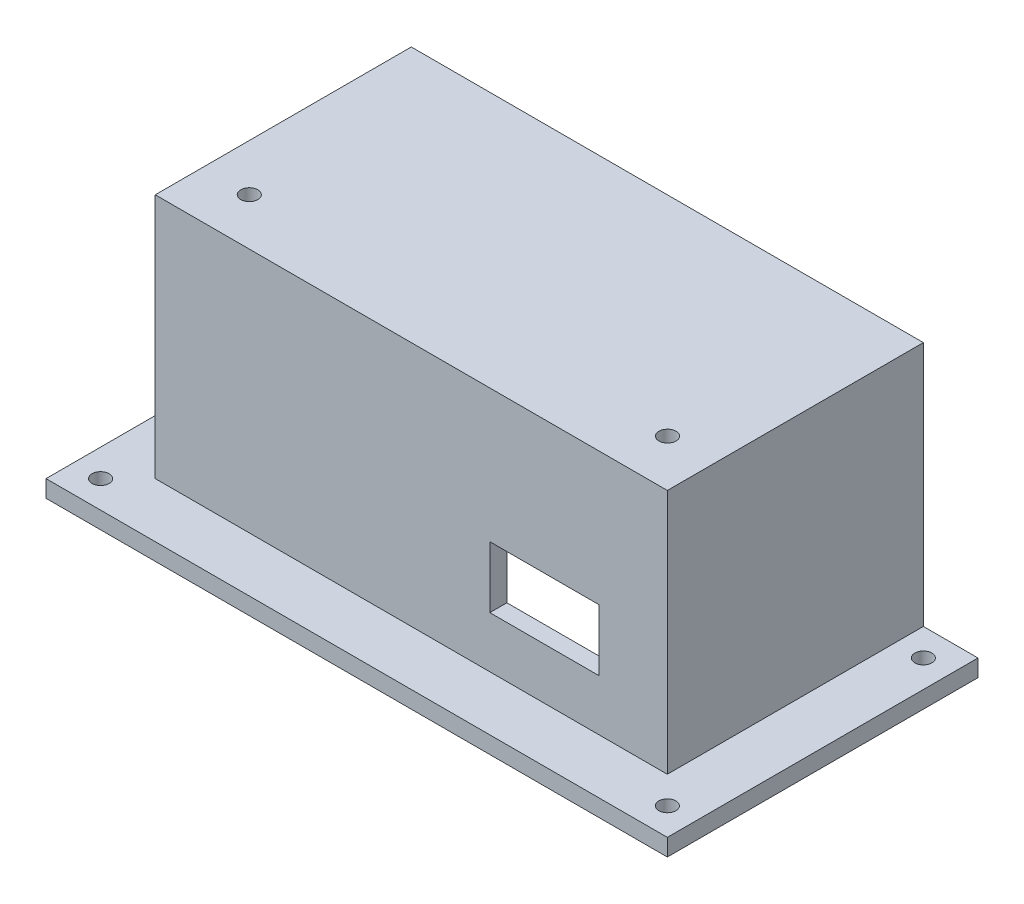
from build123d import *

# Parameters (mm, degrees)
SKETCH1_W                = 88.9
SKETCH1_H                = 44.45
BOSS_EXTRUDE1_DEPTH      = 3.175
BOSS_EXTRUDE2_DEPTH      = 45.72
BOSS_EXTRUDE2_DEPTH_BACK = 3.175
SKETCH3_R                = 1.5875
CUT_EXTRUDE1_DEPTH       = 45.72
SKETCH4_W                = 10.16
SKETCH4_H                = 47.625
SKETCH4_H_2              = 10.16
SKETCH4_W_2              = 95.25
BOSS_EXTRUDE3_DEPTH      = 3.175
SKETCH5_R                = 1.5875
CUT_EXTRUDE2_DEPTH       = 3.175
SKETCH6_W                = 20.32
SKETCH6_H                = 11.43
CUT_EXTRUDE3_DEPTH       = 3.175
SKETCH7_W                = 44.45
SKETCH7_H                = 12.7
BOSS_EXTRUDE4_DEPTH      = 3.175


with BuildPart() as part:
    # Sketch1 → Boss-Extrude1 (new body)
    with BuildSketch(Plane(origin=(0, 0, 0), x_dir=(1, 0, 0), z_dir=(0, 1, 0))):
        with Locations((44.45, 22.225)):
            Rectangle(SKETCH1_W, SKETCH1_H)
    extrude(amount=BOSS_EXTRUDE1_DEPTH)

    # Sketch2 → Boss-Extrude2 (add, two sides: drawn at the far end of the back side and taken through both)
    with BuildSketch(Plane.XZ.offset(-BOSS_EXTRUDE2_DEPTH_BACK)):
        Polygon((-3.175, 3.175), (-3.175, -44.45), (0, -44.45), (0, 0), (88.9, 0), (88.9, -44.45), (92.075, -44.45), (92.075, 3.175), align=None)
    extrude(amount=BOSS_EXTRUDE2_DEPTH + BOSS_EXTRUDE2_DEPTH_BACK)

    # Sketch3 → Cut-Extrude1 (cut)
    with BuildSketch(Plane.XZ):
        with Locations(Location((83.34375, -5.588, 0), (0, 0, 270))):
            Circle(SKETCH3_R)
        with Locations(Location((5.55625, -5.588, 0), (0, 0, 270))):
            Circle(SKETCH3_R)
    extrude(amount=-CUT_EXTRUDE1_DEPTH, mode=Mode.SUBTRACT)

    # Sketch4 → Boss-Extrude3 (add)
    with BuildSketch(Plane.XZ.offset(45.72)):
        with Locations((-8.255, -20.6375)):
            Rectangle(SKETCH4_W, SKETCH4_H)
        with Locations((-8.255, 8.255)):
            Rectangle(SKETCH4_W, SKETCH4_H_2)
        with Locations((44.45, 8.255)):
            Rectangle(SKETCH4_W_2, SKETCH4_H_2)
        Polygon((92.075, -44.45), (102.235, -44.45), (102.235, 13.335), (92.075, 13.335), (92.075, 3.175), align=None)
    extrude(amount=-BOSS_EXTRUDE3_DEPTH)

    # Sketch5 → Cut-Extrude2 (cut)
    with BuildSketch(Plane(origin=(0, -42.545, 0), x_dir=(1, 0, 0), z_dir=(0, 1, 0))):
        with Locations(Location((-8.255, 39.37, 0), (0, 0, 270))):
            Circle(SKETCH5_R)
        with Locations(Location((-8.255, -8.255, 0), (0, 0, 270))):
            Circle(SKETCH5_R)
        with Locations(Location((97.155, -8.255, 0), (0, 0, 270))):
            Circle(SKETCH5_R)
        with Locations(Location((97.155, 39.37, 0), (0, 0, 270))):
            Circle(SKETCH5_R)
    extrude(amount=-CUT_EXTRUDE2_DEPTH, mode=Mode.SUBTRACT)

    # Sketch6 → Cut-Extrude3 (cut)
    with BuildSketch(Plane.XY.offset(3.175)):
        with Locations((69.215, -27.305)):
            Rectangle(SKETCH6_W, SKETCH6_H)
    extrude(amount=-CUT_EXTRUDE3_DEPTH, mode=Mode.SUBTRACT)

    # Sketch7 → Boss-Extrude4 (add)
    with BuildSketch(Plane(origin=(0, 0, -44.45), x_dir=(-1, 0, 0), z_dir=(0, 0, -1))):
        with Locations((-22.225, -8.89)):
            Rectangle(SKETCH7_W, SKETCH7_H)
        Polygon((-88.9, 0), (-88.9, -2.54), (-44.45, -2.54), (0, -2.54), (0, 0), align=None)
    extrude(amount=-BOSS_EXTRUDE4_DEPTH)


solid = part.part
